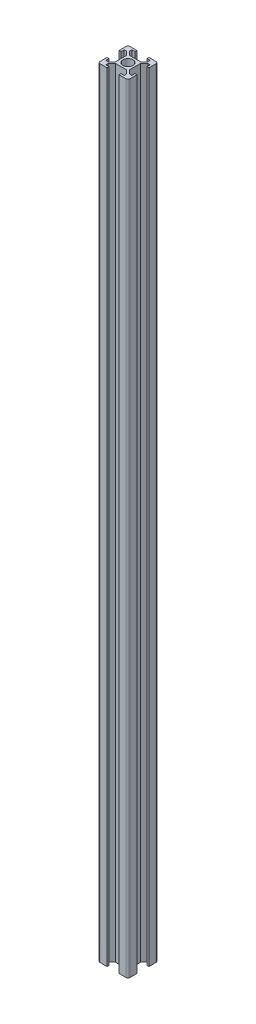
from build123d import *

# Parameters (mm, degrees)
BOSS_EXTRUDE1_DEPTH = 390


with BuildPart() as part:
    # Sketch1 → Boss-Extrude1 (new body)
    with BuildSketch(Plane(origin=(0, 0, 0), x_dir=(1, 0, 0), z_dir=(0, 1, 0))):
        with BuildLine():
            Line((-7.5, -3), (-7.5, -6.5))
            ThreePointArc((-7.5, -6.5), (-7.207106781, -7.207106781), (-6.5, -7.5))
            Line((-6.5, -7.5), (-3, -7.5))
            Line((-3, -7.5), (-3, -6.5))
            Line((-3, -6.5), (-4.6, -6.5))
            Line((-4.6, -6.5), (-4.6, -5.307106781))
            Line((-4.6, -5.307106781), (-2.8, -3.507106781))
            Line((-2.8, -3.507106781), (0, -3.507106781))
            Line((0, -3.507106781), (2.8, -3.507106781))
            Line((2.8, -3.507106781), (4.6, -5.307106781))
            Line((4.6, -5.307106781), (4.6, -6.5))
            Line((4.6, -6.5), (3, -6.5))
            Line((3, -6.5), (3, -7.5))
            Line((3, -7.5), (6.5, -7.5))
            ThreePointArc((6.5, -7.5), (7.207106781, -7.207106781), (7.5, -6.5))
            Line((7.5, -6.5), (7.5, -3))
            Line((7.5, -3), (6.5, -3))
            Line((6.5, -3), (6.5, -4.6))
            Line((6.5, -4.6), (5.307106781, -4.6))
            Line((5.307106781, -4.6), (3.507106781, -2.8))
            Line((3.507106781, -2.8), (3.507106781, 0))
            Line((3.507106781, 0), (3.507106781, 2.8))
            Line((3.507106781, 2.8), (5.307106781, 4.6))
            Line((5.307106781, 4.6), (6.5, 4.6))
            Line((6.5, 4.6), (6.5, 3))
            Line((6.5, 3), (7.5, 3))
            Line((7.5, 3), (7.5, 6.5))
            ThreePointArc((7.5, 6.5), (7.207106781, 7.207106781), (6.5, 7.5))
            Line((6.5, 7.5), (3, 7.5))
            Line((3, 7.5), (3, 6.5))
            Line((3, 6.5), (4.6, 6.5))
            Line((4.6, 6.5), (4.6, 5.307106781))
            Line((4.6, 5.307106781), (2.8, 3.507106781))
            Line((2.8, 3.507106781), (0, 3.507106781))
            Line((0, 3.507106781), (-2.8, 3.507106781))
            Line((-2.8, 3.507106781), (-4.6, 5.307106781))
            Line((-4.6, 5.307106781), (-4.6, 6.5))
            Line((-4.6, 6.5), (-3, 6.5))
            Line((-3, 6.5), (-3, 7.5))
            Line((-3, 7.5), (-6.5, 7.5))
            ThreePointArc((-6.5, 7.5), (-7.207106781, 7.207106781), (-7.5, 6.5))
            Line((-7.5, 6.5), (-7.5, 3))
            Line((-7.5, 3), (-6.5, 3))
            Line((-6.5, 3), (-6.5, 4.6))
            Line((-6.5, 4.6), (-5.307106781, 4.6))
            Line((-5.307106781, 4.6), (-3.507106781, 2.8))
            Line((-3.507106781, 2.8), (-3.507106781, 0))
            Line((-3.507106781, 0), (-3.507106781, -2.8))
            Line((-3.507106781, -2.8), (-5.307106781, -4.6))
            Line((-5.307106781, -4.6), (-6.5, -4.6))
            Line((-6.5, -4.6), (-6.5, -3))
            Line((-6.5, -3), (-7.5, -3))
        make_face()
        with BuildLine():
            ThreePointArc((-2.5, 0), (-1.767766953, -1.767766953), (0, -2.5))
            ThreePointArc((0, -2.5), (1.767766953, -1.767766953), (2.5, 0))
            ThreePointArc((2.5, 0), (1.767766953, 1.767766953), (0, 2.5))
            ThreePointArc((0, 2.5), (-1.767766953, 1.767766953), (-2.5, 0))
        make_face(mode=Mode.SUBTRACT)
    extrude(amount=BOSS_EXTRUDE1_DEPTH)


solid = part.part
